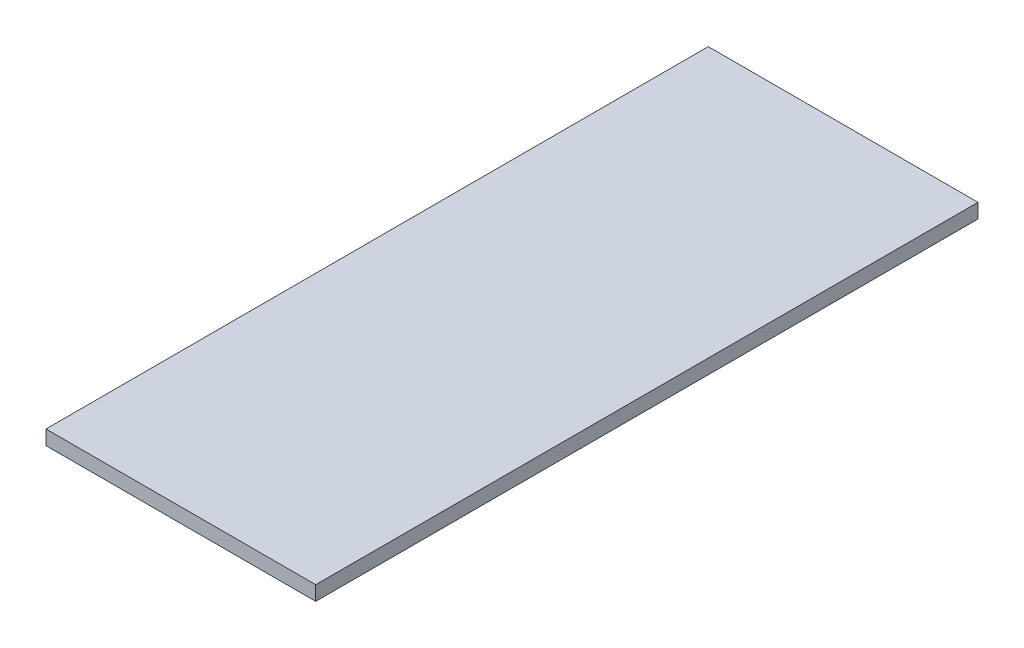
from build123d import *

# Parameters (mm, degrees)
SKETCH1_W           = 112
SKETCH1_H           = 275
BOSS_EXTRUDE1_DEPTH = 6


with BuildPart() as part:
    # Sketch1 → Boss-Extrude1 (new body)
    with BuildSketch(Plane(origin=(0, 0, 0), x_dir=(1, 0, 0), z_dir=(0, 1, 0))):
        with Locations((29.939812577, -105.874876721)):
            Rectangle(SKETCH1_W, SKETCH1_H)
    extrude(amount=BOSS_EXTRUDE1_DEPTH)


solid = part.part
